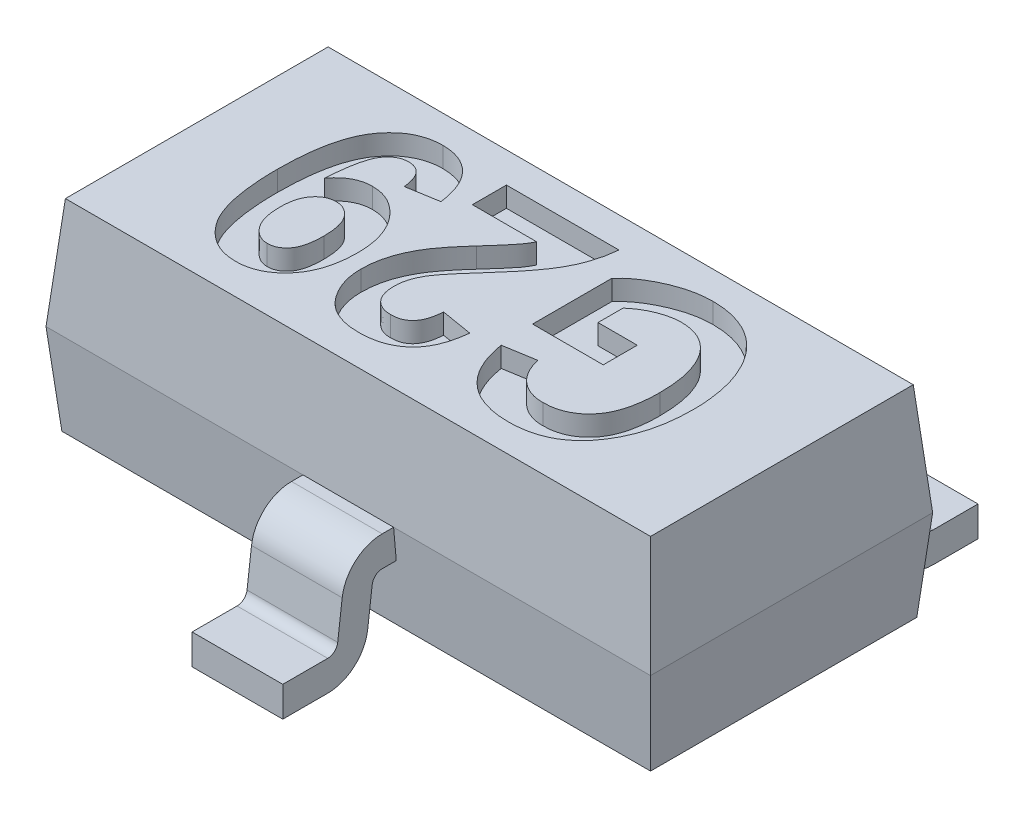
from build123d import *

# Parameters (mm, degrees)
SKETCH1_W                = 3
SKETCH1_H                = 1.4
EXTRUDE1_DEPTH           = 0.55
EXTRUDE1_TAPER           = 5
EXTRUDE1_OTHER_WAY_DEPTH = 0.45
EXTRUDE1_OTHER_WAY_TAPER = 5
EXTRUDE2_DEPTH           = 0.225
EXTRUDE2_DEPTH_BACK      = 0.225
EXTRUDE3_START           = 0.95
EXTRUDE3_DEPTH           = 0.225
FILLET1_R                = 0.05
FILLET2_R                = 0.2
CUT_EXTRUDE1_DEPTH       = 0.1


with BuildPart() as part:
    # Sketch1 → Extrude1 (new body)
    with BuildSketch(Plane(origin=(0, 0, 0), x_dir=(1, 0, 0), z_dir=(0, 1, 0))):
        Rectangle(SKETCH1_W, SKETCH1_H)
    extrude(amount=EXTRUDE1_DEPTH, taper=EXTRUDE1_TAPER)

    # Sketch1 → Extrude1 other way (add)
    with BuildSketch(Plane(origin=(0, 0, 0), x_dir=(1, 0, 0), z_dir=(0, 1, 0))):
        Rectangle(SKETCH1_W, SKETCH1_H)
    extrude(amount=-EXTRUDE1_OTHER_WAY_DEPTH, taper=EXTRUDE1_OTHER_WAY_TAPER)

    # Sketch2 → Extrude2 (add, two sides: drawn at the far end of the back side and taken through both)
    with BuildSketch(Plane(origin=(0, 0, 0), x_dir=(0, 0, -1), z_dir=(1, 0, 0)).offset(-EXTRUDE2_DEPTH_BACK)):
        Polygon((-0.585273808, 0), (-0.933594965, 0), (-0.98270879, -0.4), (-1.25, -0.4), (-1.25, -0.55), (-0.85, -0.55), (-0.800886176, -0.15), (-0.585273808, -0.15), align=None)
    extrude(amount=EXTRUDE2_DEPTH + EXTRUDE2_DEPTH_BACK)

    # Sketch2<3> → Extrude3 (add, symmetric)
    with BuildSketch(Plane(origin=(0, 0, 0), x_dir=(0, 0, -1), z_dir=(1, 0, 0)).offset(EXTRUDE3_START)):
        Polygon((0.585273808, 0), (0.933594965, 0), (0.98270879, -0.4), (1.25, -0.4), (1.25, -0.55), (0.85, -0.55), (0.800886176, -0.15), (0.585273808, -0.15), align=None)
    extrude3 = extrude(amount=EXTRUDE3_DEPTH, both=True)

    # Mirror1: Extrude3 across plane
    add(extrude3.mirror(Plane(origin=(0, 0, 0), x_dir=(0, 0, 1), z_dir=(1, 0, 0))))

    # Fillet1
    fillet1_edges = [part.edges().sort_by_distance(p)[0] for p in [
        (0, -0.4, 0.98270879),
        (0, -0.15, 0.800886176),
        (0.95, -0.15, -0.800886176),
        (0.95, -0.4, -0.98270879),
        (-0.95, -0.4, -0.98270879),
        (-0.95, -0.15, -0.800886176),
    ]]
    fillet(fillet1_edges, radius=FILLET1_R)

    # Fillet2
    fillet2_edges = [part.edges().sort_by_distance(p)[0] for p in [
        (0, 0, 0.933594965),
        (0, -0.55, 0.85),
        (0.95, 0, -0.933594965),
        (0.95, -0.55, -0.85),
        (-0.95, 0, -0.933594965),
        (-0.95, -0.55, -0.85),
    ]]
    fillet(fillet2_edges, radius=FILLET2_R)

    # Sketch3 → Cut-Extrude1 (cut)
    # profile 1 of 3: a face of its own
    with BuildSketch(Plane(origin=(0, 0.55, 0), x_dir=(1, 0, 0), z_dir=(0, 1, 0))):
        with BuildLine():
            Line((0.597278691, 0.136856284), (0.597278691, -0.031974885))
            Line((0.597278691, -0.031974885), (0.24662934, -0.031974885))
            Line((0.24662934, -0.031974885), (0.24662934, 0.360882258))
            add(Edge.make_bspline(
                [(0.24662934, 0.360882258), (0.251302897, 0.366080573), (0.260742986, 0.376580616), (0.276272115, 0.391506989), (0.293428896, 0.405624706), (0.311752177, 0.419452534), (0.331714777, 0.432370614), (0.35268328, 0.445350192), (0.375516883, 0.457074308), (0.407117875, 0.472553495), (0.447975177, 0.488744053), (0.497743373, 0.503113229), (0.547734636, 0.511764004), (0.581080151, 0.512909341), (0.597684535, 0.513479661)],
                knots=[0, 0, 0, 0, 0.640017093, 1.292766629, 1.970065331, 2.673730889, 3.393568583, 4.146747153, 4.930873975, 5.742601691, 7.369044057, 8.94735755, 10.479938107, 12, 12, 12, 12], degree=3))
            add(Edge.make_bspline(
                [(0.597684535, 0.513479661), (0.607632381, 0.513251488), (0.627291674, 0.512800565), (0.656398684, 0.510217035), (0.684592838, 0.505511455), (0.71187008, 0.499056309), (0.738212982, 0.49061182), (0.763819884, 0.480606143), (0.788316979, 0.468275709), (0.812073751, 0.454550613), (0.8344819, 0.438559557), (0.856204863, 0.421257636), (0.876157767, 0.401508022), (0.895474329, 0.380504133), (0.912995774, 0.357126828), (0.929756429, 0.332260733), (0.94487738, 0.305263726), (0.959109036, 0.276747901), (0.971878606, 0.246621975), (0.98276811, 0.215058482), (0.992208238, 0.182307438), (0.999624394, 0.148120417), (1.005483, 0.112695392), (1.009715887, 0.075992349), (1.012472349, 0.038008024), (1.012731362, 0.01219941), (1.012863106, -0.000927807)],
                knots=[0, 0, 0, 0, 0.962920881, 1.902958989, 2.825323209, 3.727247941, 4.613400776, 5.50085852, 6.385050382, 7.265331538, 8.153489274, 9.047107319, 9.949910738, 10.867663224, 11.806492338, 12.774274749, 13.76818744, 14.798767193, 15.857835699, 16.932391685, 18.028587054, 19.154790077, 20.31608616, 21.502484085, 22.729670987, 24, 24, 24, 24], degree=3))
            add(Edge.make_bspline(
                [(1.012863106, -0.000927807), (1.012730407, -0.014325365), (1.012469431, -0.040674089), (1.009728765, -0.079403776), (1.005480347, -0.116712379), (0.999696413, -0.152574204), (0.992020536, -0.186947188), (0.982364182, -0.21976079), (0.971316401, -0.251181979), (0.958488861, -0.28103658), (0.944349755, -0.309135146), (0.929048999, -0.335465262), (0.912804892, -0.359947516), (0.895891546, -0.382965942), (0.877189897, -0.403512163), (0.858071749, -0.422778002), (0.837550027, -0.439813017), (0.816338946, -0.455370952), (0.793766006, -0.468767929), (0.77035948, -0.480580474), (0.745728156, -0.490318401), (0.720125914, -0.498495132), (0.693316462, -0.504760122), (0.665433361, -0.509108994), (0.636577679, -0.51216046), (0.616970343, -0.512381951), (0.60701895, -0.512494365)],
                knots=[0, 0, 0, 0, 1.312124902, 2.580531149, 3.800962381, 4.989319339, 6.136992429, 7.248228292, 8.337923441, 9.397554488, 10.428693974, 11.41734378, 12.378412785, 13.305988605, 14.211654334, 15.097125183, 15.96241178, 16.821205676, 17.671136387, 18.530415745, 19.386726943, 20.262602489, 21.160968268, 22.080296481, 23.025684883, 24, 24, 24, 24], degree=3))
            add(Edge.make_bspline(
                [(0.60701895, -0.512494365), (0.595104632, -0.512271371), (0.571893636, -0.511836943), (0.537949115, -0.50813961), (0.505892426, -0.501928478), (0.475660698, -0.493073934), (0.447076319, -0.48223803), (0.420326662, -0.468571112), (0.395550899, -0.452222018), (0.372442675, -0.433681238), (0.351243268, -0.412707318), (0.332169648, -0.389241634), (0.31498467, -0.36352211), (0.300107772, -0.335404723), (0.286776295, -0.305126421), (0.275457993, -0.272505278), (0.266359008, -0.237455791), (0.261899479, -0.213215998), (0.259616353, -0.200806053)],
                knots=[0, 0, 0, 0, 1.106820131, 2.156262386, 3.168241489, 4.136901556, 5.080001637, 6.004787351, 6.921722851, 7.833603946, 8.753571641, 9.687094076, 10.638866524, 11.623041673, 12.638994531, 13.710359764, 14.827782594, 16, 16, 16, 16], degree=3))
            Line((0.259616353, -0.200806053), (0.415460509, -0.174832027))
            add(Edge.make_bspline(
                [(0.415460509, -0.174832027), (0.417125556, -0.181487989), (0.420384907, -0.194517113), (0.426756902, -0.213207439), (0.433942147, -0.230810994), (0.442693023, -0.246936194), (0.45157111, -0.262366379), (0.462166855, -0.276169349), (0.473393848, -0.289028992), (0.485888879, -0.300385734), (0.499094928, -0.310502829), (0.512822915, -0.319544263), (0.527453699, -0.326864836), (0.542618068, -0.332884596), (0.558321544, -0.337861956), (0.574698525, -0.341293519), (0.591678109, -0.343360204), (0.603225238, -0.343561625), (0.609048171, -0.343663196)],
                knots=[0, 0, 0, 0, 1.177170252, 2.304324627, 3.386761505, 4.43580675, 5.451291577, 6.43816544, 7.416809496, 8.378222066, 9.330335879, 10.270696948, 11.194936554, 12.132785682, 13.069196392, 14.018758376, 15.000908526, 16, 16, 16, 16], degree=3))
            add(Edge.make_bspline(
                [(0.609048171, -0.343663196), (0.618057813, -0.343450813), (0.635757555, -0.343033579), (0.661632487, -0.339114701), (0.686155615, -0.332541348), (0.709459118, -0.323687939), (0.73128209, -0.311917838), (0.751956435, -0.297922501), (0.771097963, -0.281035406), (0.789035105, -0.261804505), (0.805088539, -0.23973069), (0.819224416, -0.215008577), (0.830786582, -0.187468554), (0.840733336, -0.157470846), (0.847741516, -0.124565919), (0.853270903, -0.089151231), (0.856527298, -0.050974789), (0.856851349, -0.024675901), (0.85701895, -0.011073911)],
                knots=[0, 0, 0, 0, 0.921673952, 1.81065913, 2.670429948, 3.516377002, 4.355669447, 5.202465874, 6.066018856, 6.962493013, 7.888835012, 8.853124521, 9.870310711, 10.940846582, 12.082947074, 13.308778269, 14.60807903, 16, 16, 16, 16], degree=3))
            add(Edge.make_bspline(
                [(0.85701895, -0.011073911), (0.856779725, 0.003542744), (0.856316077, 0.031871711), (0.852905819, 0.073032104), (0.84699764, 0.111456506), (0.839090722, 0.147377321), (0.82823727, 0.180439108), (0.815486251, 0.210946889), (0.800433001, 0.238837093), (0.78802879, 0.255364153), (0.781937781, 0.263479661)],
                knots=[0, 0, 0, 0, 1.209854594, 2.3448546, 3.415453793, 4.426010799, 5.385683306, 6.291444689, 7.161024792, 8, 8, 8, 8], degree=3))
            add(Edge.make_bspline(
                [(0.781937781, 0.263479661), (0.776478419, 0.269985621), (0.765747627, 0.282773581), (0.747214795, 0.299161617), (0.727667566, 0.313477921), (0.70634719, 0.324782312), (0.683721216, 0.333849002), (0.65956632, 0.340020267), (0.634075727, 0.34405187), (0.616572348, 0.344446716), (0.607627717, 0.344648492)],
                knots=[0, 0, 0, 0, 1.020747931, 2.006357652, 2.968701255, 3.930183823, 4.9021189, 5.895229462, 6.924413603, 8, 8, 8, 8], degree=3))
            add(Edge.make_bspline(
                [(0.607627717, 0.344648492), (0.599019129, 0.344371318), (0.581497896, 0.343807179), (0.555032056, 0.339210526), (0.527923989, 0.332447635), (0.500877825, 0.322392512), (0.474226268, 0.310377443), (0.448719809, 0.296125665), (0.424721495, 0.279686153), (0.409885627, 0.267255207), (0.402473496, 0.261044596)],
                knots=[0, 0, 0, 0, 0.913361756, 1.858983559, 2.844760099, 3.876066978, 4.917276381, 5.946055144, 6.973830954, 8, 8, 8, 8], degree=3))
            Line((0.402473496, 0.261044596), (0.402473496, 0.136856284))
            Line((0.402473496, 0.136856284), (0.597278691, 0.136856284))
        make_face()
    # profile 2 of 3: a face of its own
    with BuildSketch(Plane(origin=(0, 0.55, 0), x_dir=(1, 0, 0), z_dir=(0, 1, 0))):
        with BuildLine():
            Line((-0.415708322, 0.331661479), (-0.415708322, 0.500492648))
            Line((-0.415708322, 0.500492648), (0.142733236, 0.500492648))
            add(Edge.make_bspline(
                [(0.142733236, 0.500492648), (0.140762849, 0.483866419), (0.136827428, 0.450659134), (0.125021793, 0.401865752), (0.10867883, 0.354335174), (0.091209859, 0.315512832), (0.073788824, 0.284211793), (0.058232642, 0.258657514), (0.039657525, 0.231548423), (0.018416605, 0.202629825), (-0.005461519, 0.171903439), (-0.03213941, 0.139374551), (-0.061571371, 0.10513295), (-0.082334968, 0.081896709), (-0.093062219, 0.069891999)],
                knots=[0, 0, 0, 0, 1.202815009, 2.402362028, 3.600330928, 4.812516718, 5.456765873, 6.174838876, 6.962514926, 7.818431152, 8.754172199, 9.759747227, 10.84260169, 12, 12, 12, 12], degree=3))
            add(Edge.make_bspline(
                [(-0.093062219, 0.069891999), (-0.101473437, 0.06051088), (-0.11756485, 0.042563961), (-0.14019882, 0.016575139), (-0.160558008, -0.006795142), (-0.177993593, -0.028029338), (-0.193119949, -0.046683457), (-0.205655983, -0.063041862), (-0.215752042, -0.076962746), (-0.221148385, -0.085721248), (-0.223541115, -0.089604755)],
                knots=[0, 0, 0, 0, 1.465870871, 2.804341841, 4.009590698, 5.071600616, 6.000740577, 6.80347298, 7.469461756, 8, 8, 8, 8], degree=3))
            add(Edge.make_bspline(
                [(-0.223541115, -0.089604755), (-0.229094281, -0.099552527), (-0.239934183, -0.118970798), (-0.251222229, -0.149742491), (-0.258600557, -0.18056966), (-0.259446075, -0.201306818), (-0.259864167, -0.211560923)],
                knots=[0, 0, 0, 0, 1.060288104, 2.069705834, 3.04550853, 4, 4, 4, 4], degree=3))
            add(Edge.make_bspline(
                [(-0.259864167, -0.211560923), (-0.259506823, -0.221806511), (-0.258830347, -0.241202065), (-0.25297682, -0.268359458), (-0.243299173, -0.291686527), (-0.229427988, -0.310848445), (-0.212165776, -0.325547906), (-0.192315729, -0.336180706), (-0.170029278, -0.34264836), (-0.154321082, -0.343318119), (-0.146227803, -0.343663196)],
                knots=[0, 0, 0, 0, 1.245032197, 2.356925714, 3.359432541, 4.295783246, 5.205998414, 6.09309012, 7.017509524, 8, 8, 8, 8], degree=3))
            add(Edge.make_bspline(
                [(-0.146227803, -0.343663196), (-0.137454783, -0.343278442), (-0.120639752, -0.342540992), (-0.096968208, -0.335716583), (-0.076458994, -0.32435182), (-0.059396994, -0.308192789), (-0.045872112, -0.28752113), (-0.035831972, -0.262481049), (-0.029023704, -0.233112755), (-0.027112073, -0.2120043), (-0.026097933, -0.200806053)],
                knots=[0, 0, 0, 0, 0.999757542, 1.91621054, 2.784003759, 3.652621159, 4.571413543, 5.582410499, 6.717444591, 8, 8, 8, 8], degree=3))
            Line((-0.026097933, -0.200806053), (0.129746223, -0.226780079))
            add(Edge.make_bspline(
                [(0.129746223, -0.226780079), (0.128441211, -0.23817226), (0.125909642, -0.260271741), (0.119206758, -0.292014963), (0.111266638, -0.321519104), (0.101331524, -0.348637875), (0.089526311, -0.373384576), (0.075890622, -0.395843882), (0.060475129, -0.416080008), (0.043076516, -0.433829821), (0.024075101, -0.449293468), (0.00368469, -0.462764456), (-0.018199394, -0.474199595), (-0.041570449, -0.483574457), (-0.066575226, -0.490574316), (-0.092938701, -0.495920821), (-0.12085979, -0.498939183), (-0.139930241, -0.499315176), (-0.149677478, -0.499507352)],
                knots=[0, 0, 0, 0, 1.257277449, 2.438969413, 3.555122979, 4.606890186, 5.602584943, 6.558324939, 7.484454118, 8.387006599, 9.278232025, 10.16732337, 11.063477837, 11.98256456, 12.924375971, 13.908137147, 14.9308127, 16, 16, 16, 16], degree=3))
            add(Edge.make_bspline(
                [(-0.149677478, -0.499507352), (-0.160375117, -0.499214497), (-0.181098579, -0.498647178), (-0.211248106, -0.494841757), (-0.239231997, -0.488112388), (-0.265405772, -0.479035735), (-0.289358432, -0.466925794), (-0.311599948, -0.452575653), (-0.331307209, -0.435000383), (-0.349153707, -0.415418724), (-0.364559562, -0.393880649), (-0.378166288, -0.371553653), (-0.389971458, -0.348515496), (-0.399080874, -0.324471546), (-0.406902814, -0.299898449), (-0.411677052, -0.274399594), (-0.415234929, -0.248254333), (-0.415548888, -0.230513309), (-0.415708322, -0.221504105)],
                knots=[0, 0, 0, 0, 1.186211717, 2.297928972, 3.362154236, 4.3727221, 5.362223315, 6.331622294, 7.298958998, 8.281270799, 9.263926147, 10.229953495, 11.179209739, 12.12911764, 13.078136807, 14.034242713, 15.001753863, 16, 16, 16, 16], degree=3))
            add(Edge.make_bspline(
                [(-0.415708322, -0.221504105), (-0.415533533, -0.211281058), (-0.415185373, -0.190917933), (-0.411762059, -0.160685546), (-0.406558272, -0.130893213), (-0.398974224, -0.101532782), (-0.389120091, -0.072342675), (-0.377127376, -0.043130349), (-0.362915277, -0.013801134), (-0.348920765, 0.010499925), (-0.336381329, 0.030688851), (-0.325215361, 0.046826018), (-0.312490068, 0.063906883), (-0.298562225, 0.08221885), (-0.282885716, 0.101409432), (-0.265842831, 0.121707003), (-0.247373978, 0.143016186), (-0.234452348, 0.157437749), (-0.227802478, 0.164859531)],
                knots=[0, 0, 0, 0, 1.112563442, 2.216097518, 3.308146812, 4.402998112, 5.513781081, 6.65974264, 7.838800208, 9.05908204, 9.710862989, 10.42577165, 11.194588916, 12.029705768, 12.930215825, 13.891935437, 14.915124831, 16, 16, 16, 16], degree=3))
            add(Edge.make_bspline(
                [(-0.227802478, 0.164859531), (-0.22162726, 0.171673487), (-0.209820113, 0.184701912), (-0.19330341, 0.203548056), (-0.178422598, 0.220458377), (-0.165243928, 0.2354249), (-0.15378894, 0.24860762), (-0.144356344, 0.260128613), (-0.136580808, 0.269736616), (-0.125158009, 0.284058535), (-0.111509121, 0.304230558), (-0.1016399, 0.322784099), (-0.096917738, 0.331661479)],
                knots=[0, 0, 0, 0, 1.297119841, 2.480120354, 3.534763852, 4.474517179, 5.293121491, 5.998013172, 6.574687284, 7.036626064, 8.582103637, 10, 10, 10, 10], degree=3))
            Line((-0.096917738, 0.331661479), (-0.415708322, 0.331661479))
        make_face()
    # profile 3 of 3: a face of its own
    with BuildSketch(Plane(origin=(0, 0.55, 0), x_dir=(1, 0, 0), z_dir=(0, 1, 0))):
        with BuildLine():
            Line((-0.506617413, 0.266726414), (-0.662461569, 0.240752388))
            add(Edge.make_bspline(
                [(-0.662461569, 0.240752388), (-0.663601881, 0.249920802), (-0.665753527, 0.267220609), (-0.672021369, 0.291186057), (-0.680438248, 0.311616095), (-0.691254923, 0.328460837), (-0.704519162, 0.341759825), (-0.720333031, 0.350987828), (-0.73830764, 0.356722048), (-0.751026055, 0.357323243), (-0.757632024, 0.357635505)],
                knots=[0, 0, 0, 0, 1.319326323, 2.489426106, 3.529051563, 4.464831828, 5.333004823, 6.186850188, 7.058246609, 8, 8, 8, 8], degree=3))
            add(Edge.make_bspline(
                [(-0.757632024, 0.357635505), (-0.76224671, 0.35750536), (-0.771352086, 0.357248568), (-0.784629521, 0.354427902), (-0.797342662, 0.350285801), (-0.809229847, 0.343946947), (-0.8206213, 0.336307014), (-0.831298317, 0.326791023), (-0.841242794, 0.315514536), (-0.850745387, 0.302372611), (-0.8594794, 0.286502759), (-0.867055234, 0.267245785), (-0.873766002, 0.244451358), (-0.880157598, 0.218211857), (-0.885152325, 0.188338342), (-0.88996196, 0.155009081), (-0.893428019, 0.118020167), (-0.895266299, 0.092149297), (-0.896227803, 0.078617648)],
                knots=[0, 0, 0, 0, 0.644509768, 1.27170181, 1.891065764, 2.508910159, 3.149239279, 3.806131369, 4.503095468, 5.248833404, 6.070425375, 7.029753264, 8.137220271, 9.392531812, 10.804994007, 12.37190321, 14.102339405, 16, 16, 16, 16], degree=3))
            add(Edge.make_bspline(
                [(-0.896227803, 0.078617648), (-0.891092597, 0.085299121), (-0.88108548, 0.098319493), (-0.864099353, 0.115362243), (-0.846382777, 0.130003009), (-0.827477665, 0.141900393), (-0.80752853, 0.1512924), (-0.786474208, 0.158076636), (-0.764334326, 0.161937197), (-0.749259117, 0.162529454), (-0.74160118, 0.16283031)],
                knots=[0, 0, 0, 0, 1.102851612, 2.149157288, 3.144120137, 4.107738306, 5.066947047, 6.025255083, 6.996864834, 8, 8, 8, 8], degree=3))
            add(Edge.make_bspline(
                [(-0.74160118, 0.16283031), (-0.73353794, 0.162538426), (-0.717579178, 0.161960727), (-0.693993462, 0.157911162), (-0.671383296, 0.150540832), (-0.649174699, 0.141084781), (-0.627918033, 0.128326127), (-0.607256324, 0.112965815), (-0.587339437, 0.094820649), (-0.568446796, 0.073994365), (-0.550843509, 0.05112195), (-0.535506211, 0.026083924), (-0.52248575, -0.000749089), (-0.511988298, -0.029545323), (-0.50364775, -0.060010264), (-0.49778241, -0.092325498), (-0.49434556, -0.126461515), (-0.493872544, -0.149864627), (-0.4936304, -0.161845014)],
                knots=[0, 0, 0, 0, 0.85323437, 1.688721104, 2.521782171, 3.364838311, 4.237633178, 5.13807754, 6.08562357, 7.083726375, 8.110171319, 9.135217767, 10.185225352, 11.260901033, 12.373935033, 13.523737495, 14.732365797, 16, 16, 16, 16], degree=3))
            add(Edge.make_bspline(
                [(-0.4936304, -0.161845014), (-0.493851156, -0.174638004), (-0.494280774, -0.199534767), (-0.497987892, -0.235829147), (-0.504058525, -0.269937751), (-0.51228734, -0.302125365), (-0.523297491, -0.332101999), (-0.536455371, -0.360221913), (-0.552360173, -0.386001664), (-0.570415639, -0.40956499), (-0.590221822, -0.430550645), (-0.61126673, -0.448993851), (-0.633346419, -0.464738992), (-0.656826211, -0.477432336), (-0.681294453, -0.487442425), (-0.707016722, -0.494278219), (-0.733734093, -0.498744452), (-0.751999442, -0.499250237), (-0.761284621, -0.499507352)],
                knots=[0, 0, 0, 0, 1.272192378, 2.475845984, 3.623993693, 4.715679544, 5.775599675, 6.795786042, 7.798497229, 8.782158632, 9.743549784, 10.663782226, 11.561633104, 12.434691505, 13.312970574, 14.184498225, 15.077090781, 16, 16, 16, 16], degree=3))
            add(Edge.make_bspline(
                [(-0.761284621, -0.499507352), (-0.771661776, -0.499181304), (-0.792025271, -0.498541487), (-0.82177789, -0.492742175), (-0.850261695, -0.483963992), (-0.87717115, -0.470933007), (-0.902781007, -0.454520467), (-0.927040961, -0.434563252), (-0.949581562, -0.410650911), (-0.97112596, -0.383414858), (-0.990506776, -0.351699119), (-1.007116989, -0.315224635), (-1.020919189, -0.274024021), (-1.032461165, -0.228237589), (-1.041209142, -0.177687651), (-1.04763647, -0.122413669), (-1.051477505, -0.062332568), (-1.051869049, -0.02068469), (-1.052071959, 0.000898492)],
                knots=[0, 0, 0, 0, 0.768499748, 1.508056972, 2.239117284, 2.97251249, 3.716661965, 4.489647079, 5.294688835, 6.148297677, 7.05986333, 8.042545481, 9.112875999, 10.276712121, 11.53965529, 12.912925547, 14.400185197, 16, 16, 16, 16], degree=3))
            add(Edge.make_bspline(
                [(-1.052071959, 0.000898492), (-1.051804402, 0.022888267), (-1.051288557, 0.065284133), (-1.047224638, 0.126444655), (-1.040626382, 0.182816049), (-1.031505148, 0.23446765), (-1.019345316, 0.281353496), (-1.004673382, 0.323532018), (-0.987311572, 0.360983836), (-0.967053746, 0.393584654), (-0.944515377, 0.421735709), (-0.920514568, 0.446218143), (-0.895039577, 0.467262823), (-0.867690091, 0.484152546), (-0.838768154, 0.497306743), (-0.80828241, 0.506618701), (-0.776192005, 0.5125386), (-0.754208587, 0.513162281), (-0.743021634, 0.513479661)],
                knots=[0, 0, 0, 0, 1.571473948, 3.029771661, 4.378309524, 5.626165711, 6.77523796, 7.836316414, 8.813790187, 9.719241878, 10.57236224, 11.385942505, 12.165865731, 12.927844048, 13.676393564, 14.430231709, 15.201174067, 16, 16, 16, 16], degree=3))
            add(Edge.make_bspline(
                [(-0.743021634, 0.513479661), (-0.735233466, 0.513281858), (-0.720009854, 0.512895209), (-0.697674297, 0.509945662), (-0.676396856, 0.505357543), (-0.656105858, 0.498845113), (-0.636901518, 0.490294336), (-0.618873427, 0.479620161), (-0.601626954, 0.467423772), (-0.585553834, 0.453151967), (-0.570758997, 0.436876371), (-0.557196681, 0.418652341), (-0.545330274, 0.398299753), (-0.534734237, 0.375948896), (-0.525356637, 0.351636976), (-0.517829471, 0.325093889), (-0.511202556, 0.296674531), (-0.508174667, 0.276897704), (-0.506617413, 0.266726414)],
                knots=[0, 0, 0, 0, 0.986489393, 1.928300946, 2.849494017, 3.741152269, 4.623495205, 5.506878028, 6.391548611, 7.29612775, 8.224270922, 9.173848844, 10.16890029, 11.203893969, 12.305273289, 13.46600407, 14.696757149, 16, 16, 16, 16], degree=3))
        make_face()
        with BuildLine():
            add(Edge.make_bspline(
                [(-0.88324079, -0.157177807), (-0.883140773, -0.164488587), (-0.882946888, -0.178660744), (-0.880972087, -0.199238791), (-0.878383294, -0.218565164), (-0.873885844, -0.236525339), (-0.868917524, -0.253382986), (-0.861996767, -0.26868051), (-0.854351411, -0.282833792), (-0.845419946, -0.295567222), (-0.835720502, -0.306796602), (-0.825789857, -0.316722241), (-0.815258471, -0.324857639), (-0.804617917, -0.331819447), (-0.793576561, -0.337172125), (-0.782234188, -0.340842584), (-0.77057803, -0.343166717), (-0.762648211, -0.343496686), (-0.758646634, -0.343663196)],
                knots=[0, 0, 0, 0, 1.410471939, 2.734240331, 3.987849669, 5.168938465, 6.304413718, 7.374118349, 8.402475803, 9.405665721, 10.36854681, 11.264020894, 12.11017516, 12.932218667, 13.71464124, 14.470134825, 15.227993381, 16, 16, 16, 16], degree=3))
            add(Edge.make_bspline(
                [(-0.758646634, -0.343663196), (-0.75106808, -0.343242316), (-0.736188114, -0.342415946), (-0.715093408, -0.334398008), (-0.696136849, -0.321650977), (-0.682622496, -0.307039145), (-0.672997809, -0.293044681), (-0.666732178, -0.280437757), (-0.661334283, -0.266300363), (-0.656770058, -0.250508704), (-0.653740452, -0.233071701), (-0.651295404, -0.214048889), (-0.649575564, -0.193396412), (-0.64950903, -0.179029433), (-0.649474556, -0.171585274)],
                knots=[0, 0, 0, 0, 1.187641509, 2.331851949, 3.497227864, 4.753938428, 5.435485423, 6.163357286, 6.961452766, 7.813315945, 8.743838078, 9.74132627, 10.82968254, 12, 12, 12, 12], degree=3))
            add(Edge.make_bspline(
                [(-0.649474556, -0.171585274), (-0.649632705, -0.164144793), (-0.649939224, -0.149723842), (-0.65111551, -0.128810107), (-0.654154843, -0.109547192), (-0.657599947, -0.091701305), (-0.662597738, -0.075558817), (-0.668053687, -0.060680965), (-0.675351785, -0.047717486), (-0.685595599, -0.032518635), (-0.700526397, -0.016949543), (-0.720869877, -0.003062436), (-0.743442136, 0.005611873), (-0.759315381, 0.006523456), (-0.767372283, 0.006986154)],
                knots=[0, 0, 0, 0, 1.117456673, 2.165826254, 3.140963096, 4.043152256, 4.891316167, 5.675812578, 6.416565175, 7.117916696, 8.42510396, 9.624932706, 10.794469286, 12, 12, 12, 12], degree=3))
            add(Edge.make_bspline(
                [(-0.767372283, 0.006986154), (-0.775085117, 0.006484149), (-0.790369701, 0.00548932), (-0.81225935, -0.002742473), (-0.832353267, -0.015856854), (-0.847005646, -0.030855907), (-0.857369612, -0.045155416), (-0.864277366, -0.057422902), (-0.870141612, -0.070894686), (-0.875087375, -0.085601614), (-0.878636897, -0.101737825), (-0.881219292, -0.119097175), (-0.882882575, -0.137733428), (-0.883118604, -0.150545385), (-0.88324079, -0.157177807)],
                knots=[0, 0, 0, 0, 1.232798733, 2.443046859, 3.696633057, 5.053145575, 5.775089257, 6.522534753, 7.303865589, 8.126429872, 9.004594563, 9.947271913, 10.937355308, 12, 12, 12, 12], degree=3))
        make_face(mode=Mode.SUBTRACT)
    extrude(amount=-CUT_EXTRUDE1_DEPTH, mode=Mode.SUBTRACT)


solid = part.part
